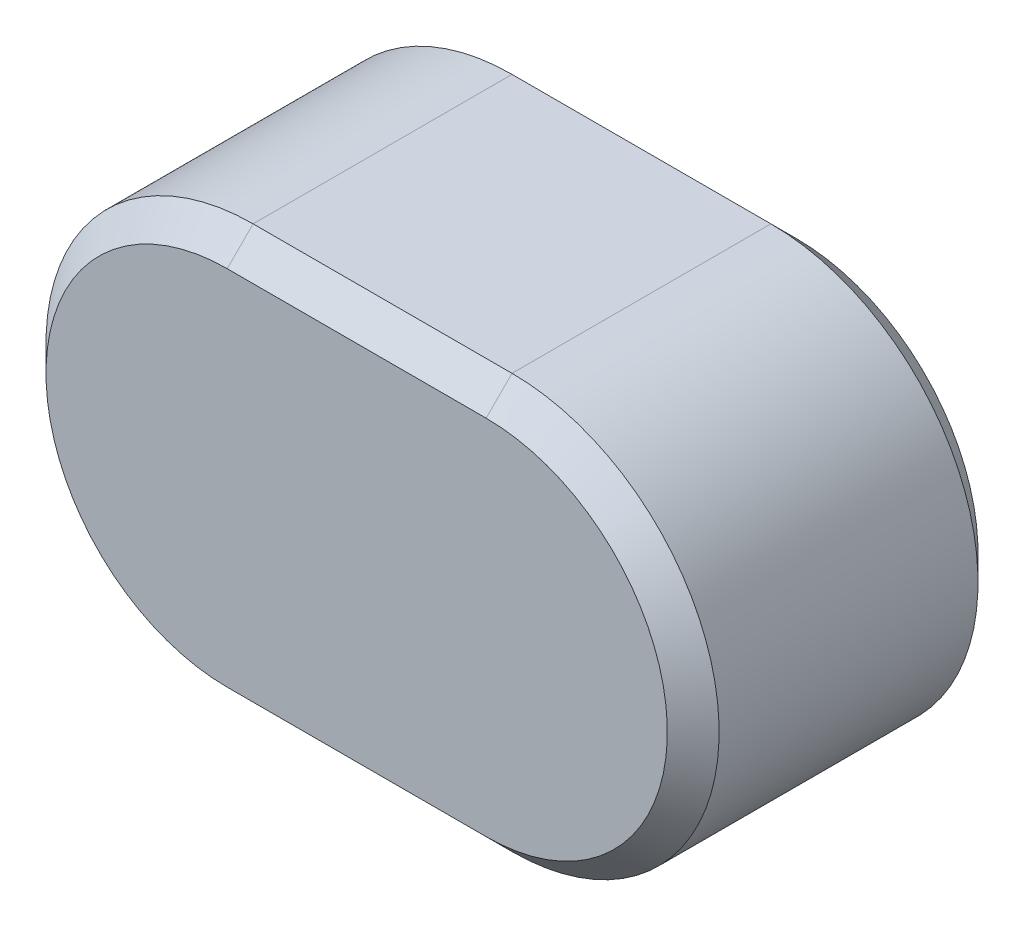
from build123d import *

# Parameters (mm, degrees)
ESTRUSIONE_ESTRUSIONE1_DEPTH = 6
SMUSSO1_SIZE                 = 0.5


with BuildPart() as part:
    # Schizzo1 → Estrusione-Estrusione1 (new body)
    with BuildSketch(Plane.XY):
        with BuildLine():
            Line((-2.5, 4), (2.5, 4))
            ThreePointArc((2.5, 4), (6.5, 0), (2.5, -4))
            Line((2.5, -4), (-2.5, -4))
            ThreePointArc((-2.5, -4), (-6.5, 0), (-2.5, 4))
        make_face()
    extrude(amount=ESTRUSIONE_ESTRUSIONE1_DEPTH)

    # Smusso1
    smusso1_edges = [part.edges().sort_by_distance(p)[0] for p in [
        (6.5, 0, 6),
        (0, 4, 6),
        (-6.5, 0, 6),
        (0, 4, 0),
        (6.5, 0, 0),
        (0, -4, 0),
        (-6.5, 0, 0),
        (0, -4, 6),
    ]]
    chamfer(smusso1_edges, length=SMUSSO1_SIZE)


solid = part.part
